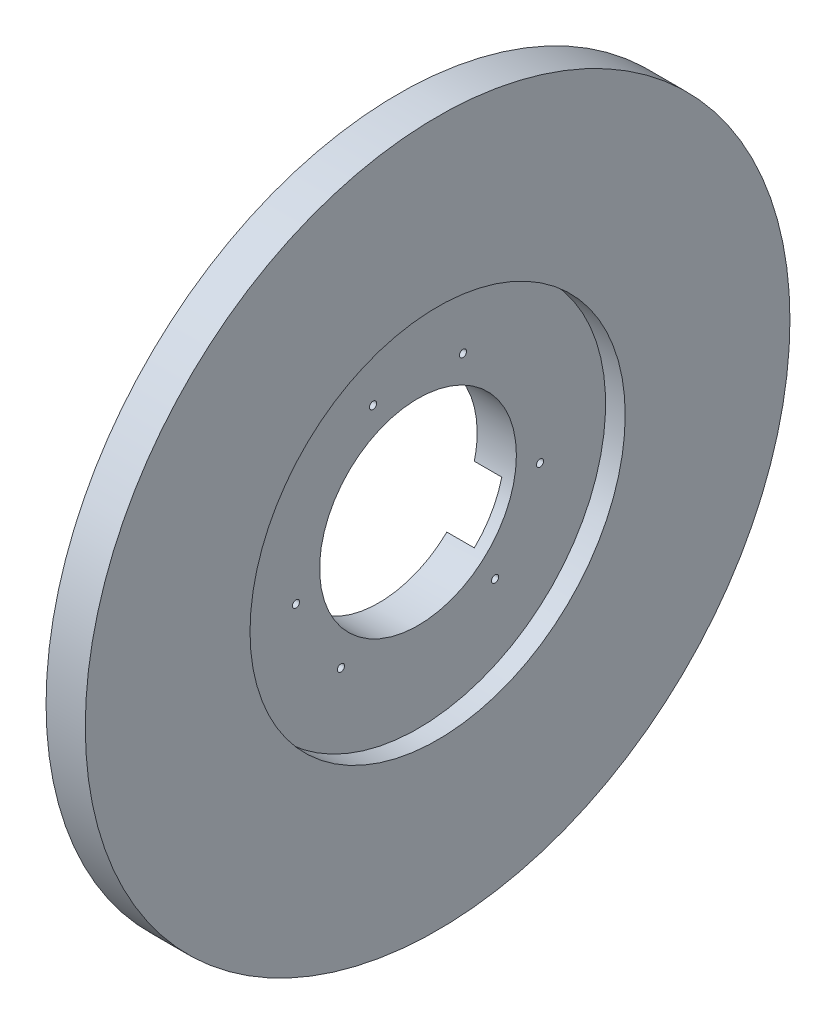
from build123d import *

# Parameters (mm, degrees)
SKETCH1_R                   = 89.825
SKETCH1_R_2                 = 47.825
BOSS_EXTRUDE1_DEPTH         = 10
SKETCH3_R                   = 47.825
TBH_IDK_DEPTH               = 5
EXTRUSION_START             = 5
SKETCH4_R                   = 47.825
EXTRUSION_TO_FUEL_MAN_DEPTH = 5
OX_DOWNCOMER_REACH          = 129.914
OX_PROFILE_R                = 0.914623685
OX_ORIFICES_COUNT           = 3
SKETCH7_R                   = 47.825
FUEL_BLOCKERS_DEPTH         = 5
SKETCH8_R                   = 25.085
TI_CUT_EXTRUDE_DEPTH        = 128.424727781
SKETCH9_R                   = 51.325
FUEL_VOLUME_DEPTH           = 2


with BuildPart() as part:
    # Sketch1 → Boss-Extrude1 (new body)
    with BuildSketch(Plane(origin=(0, 0, 0), x_dir=(0, 0, -1), z_dir=(1, 0, 0))):
        Circle(SKETCH1_R)
        Circle(SKETCH1_R_2, mode=Mode.SUBTRACT)
    extrude(amount=BOSS_EXTRUDE1_DEPTH)

    # Sketch3 → tbh idk (add)
    with BuildSketch(Plane.ZY):
        Circle(SKETCH3_R)
    extrude(amount=-TBH_IDK_DEPTH)

    # Sketch4 → Extrusion to Fuel Man (add)
    with BuildSketch(Plane.ZY.offset(EXTRUSION_START)):
        Circle(SKETCH4_R)
    extrude(amount=-EXTRUSION_TO_FUEL_MAN_DEPTH)

    # Ox Profile → Ox Downcomer (cut, up to next)
    with BuildSketch(Plane.ZY.offset(5), mode=Mode.PRIVATE) as ox_downcomer_sk1:
        with Locations((11.464101615, 29.2826)):
            Circle(OX_PROFILE_R)
    ox_downcomer_tool1 = extrude(ox_downcomer_sk1.sketch, amount=-OX_DOWNCOMER_REACH, mode=Mode.PRIVATE) & part.part
    # Ox Profile → Ox Downcomer (cut, up to next)
    with BuildSketch(Plane.ZY.offset(5), mode=Mode.PRIVATE) as ox_downcomer_sk2:
        with Locations((-11.464101615, 29.2826)):
            Circle(OX_PROFILE_R)
    ox_downcomer_tool2 = extrude(ox_downcomer_sk2.sketch, amount=-OX_DOWNCOMER_REACH, mode=Mode.PRIVATE) & part.part
    ox_downcomer_1 = ox_downcomer_tool1.solids().sort_by_distance((-5, 29.2826, 11.464102))[0]
    add(ox_downcomer_1, mode=Mode.SUBTRACT)
    ox_downcomer_2 = ox_downcomer_tool2.solids().sort_by_distance((-5, 29.2826, -11.464102))[0]
    add(ox_downcomer_2, mode=Mode.SUBTRACT)
    ox_downcomer = ox_downcomer_1 + ox_downcomer_2  # Ox Downcomer as one shape, for the pattern or mirror that repeats it

    # Ox Orifices: Ox Downcomer ×3 about axis
    ox_orifices_axis = Axis((0, -0.021435438, 0), (1, 0, 0))
    for i in range(1, OX_ORIFICES_COUNT):
        add(ox_downcomer.rotate(ox_orifices_axis, i * 360 / OX_ORIFICES_COUNT), mode=Mode.SUBTRACT)

    # Sketch7 → Fuel Blockers (cut)
    with BuildSketch(Plane.ZY.offset(5)):
        Circle(SKETCH7_R)
        with BuildLine():
            Line((-33.467788335, -3.341161242), (-13.840363653, 30.654535527))
            ThreePointArc((-13.840363653, 30.654535527), (-10.753935529, 31.932975916), (-8.72023056, 29.2826))
            ThreePointArc((-8.72023056, 29.2826), (0, 20.56236944), (8.72023056, 29.2826))
            ThreePointArc((8.72023056, 29.2826), (10.753935529, 31.932975916), (13.840363653, 30.654535527))
            Line((13.840363653, 30.654535527), (33.467788335, -3.341161242))
            ThreePointArc((33.467788335, -3.341161242), (33.031736126, -6.653306599), (29.719590769, -7.089358808))
            ThreePointArc((29.719590769, -7.089358808), (17.807534297, -10.28118472), (20.999360209, -22.193241192))
            ThreePointArc((20.999360209, -22.193241192), (22.277800597, -25.279669317), (19.627424681, -27.313374285))
            Line((19.627424681, -27.313374285), (-19.627424681, -27.313374285))
            ThreePointArc((-19.627424681, -27.313374285), (-22.277800597, -25.279669317), (-20.999360209, -22.193241192))
            ThreePointArc((-20.999360209, -22.193241192), (-17.807534297, -10.28118472), (-29.719590769, -7.089358808))
            ThreePointArc((-29.719590769, -7.089358808), (-33.031736126, -6.653306599), (-33.467788335, -3.341161242))
        make_face(mode=Mode.SUBTRACT)
    extrude(amount=-FUEL_BLOCKERS_DEPTH, mode=Mode.SUBTRACT)

    # Sketch8 → TI Cut Extrude (cut, through all)
    with BuildSketch(Plane(origin=(5, 0, 0), x_dir=(0, 0, -1), z_dir=(1, 0, 0))):
        Circle(SKETCH8_R)
    extrude(amount=-TI_CUT_EXTRUDE_DEPTH, mode=Mode.SUBTRACT)

    # Sketch9 → Fuel Volume (cut)
    with BuildSketch(Plane.ZY):
        Circle(SKETCH9_R)
        with BuildLine():
            ThreePointArc((-13.840363653, 30.654535527), (-10.753935529, 31.932975916), (-8.72023056, 29.2826))
            ThreePointArc((-8.72023056, 29.2826), (-8.280001273, 26.546909971), (-7.003762198, 24.087435315))
            ThreePointArc((-7.003762198, 24.087435315), (0, 25.085), (7.003762198, 24.087435315))
            ThreePointArc((7.003762198, 24.087435315), (8.280001273, 26.546909971), (8.72023056, 29.2826))
            ThreePointArc((8.72023056, 29.2826), (10.753935529, 31.932975916), (13.840363653, 30.654535527))
            Line((13.840363653, 30.654535527), (33.467788335, -3.341161242))
            ThreePointArc((33.467788335, -3.341161242), (33.031736126, -6.653306599), (29.719590769, -7.089358808))
            ThreePointArc((29.719590769, -7.089358808), (27.130299064, -6.102763539), (24.362211994, -5.978281672))
            ThreePointArc((24.362211994, -5.978281672), (21.724247254, -12.5425), (17.358449796, -18.109153643))
            ThreePointArc((17.358449796, -18.109153643), (18.85029779, -20.444146432), (20.999360209, -22.193241192))
            ThreePointArc((20.999360209, -22.193241192), (22.277800597, -25.279669317), (19.627424681, -27.313374285))
            Line((19.627424681, -27.313374285), (-19.627424681, -27.313374285))
            ThreePointArc((-19.627424681, -27.313374285), (-22.277800597, -25.279669317), (-20.999360209, -22.193241192))
            ThreePointArc((-20.999360209, -22.193241192), (-18.85029779, -20.444146432), (-17.358449796, -18.109153643))
            ThreePointArc((-17.358449796, -18.109153643), (-21.724247254, -12.5425), (-24.362211994, -5.978281672))
            ThreePointArc((-24.362211994, -5.978281672), (-27.130299064, -6.102763539), (-29.719590769, -7.089358808))
            ThreePointArc((-29.719590769, -7.089358808), (-33.031736126, -6.653306599), (-33.467788335, -3.341161242))
            Line((-33.467788335, -3.341161242), (-13.840363653, 30.654535527))
        make_face(mode=Mode.SUBTRACT)
    extrude(amount=-FUEL_VOLUME_DEPTH, mode=Mode.SUBTRACT)


solid = part.part
